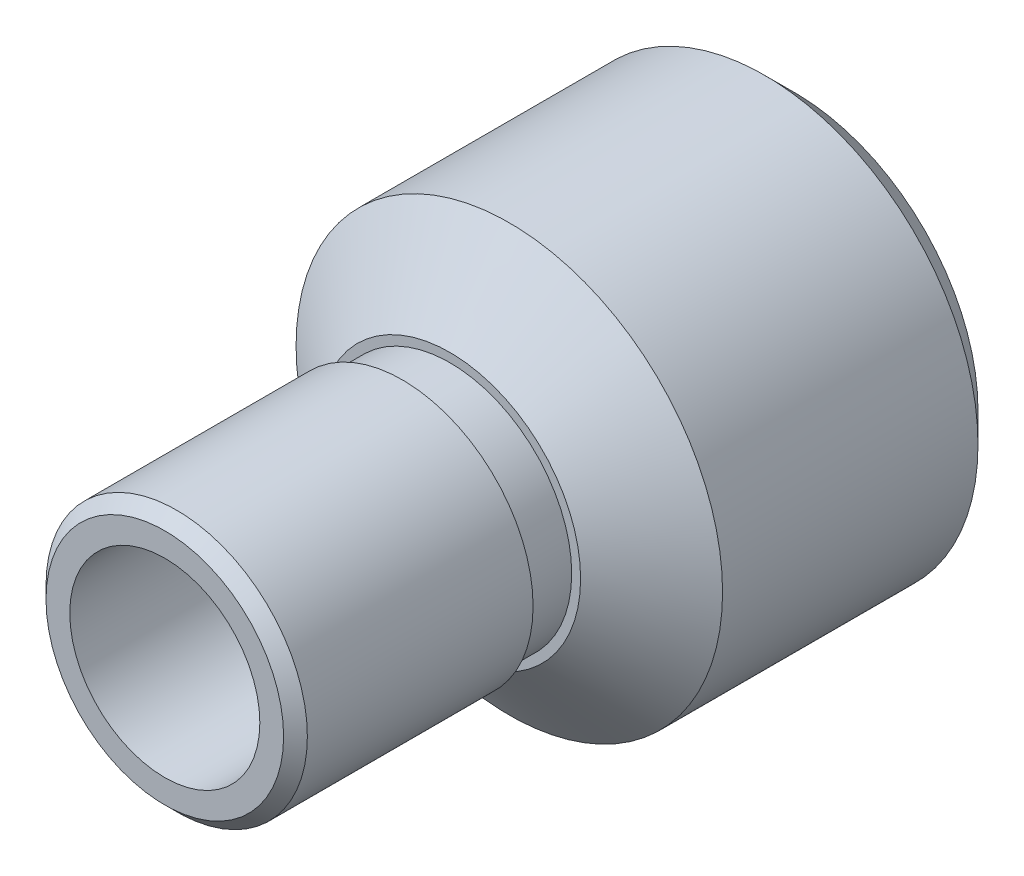
from build123d import *

# Parameters (mm, degrees)
CHAMFER1_SIZE      = 2.5
CUT_EXTRUDE1_START = -24
SKETCH3_R          = 11
SKETCH3_R_2        = 10.25
CUT_EXTRUDE1_DEPTH = 4
CHAMFER2_SIZE      = 1


with BuildPart() as part:
    # Sketch2 → Revolve1 (revolve)
    with BuildSketch(Plane(origin=(0, 0, 0), x_dir=(0, 0, -1), z_dir=(1, 0, 0))):
        Polygon((0, 11), (24, 11), (29, 17.95), (53, 17.95), (53, 14.95), (30.537419245, 14.95), (25.537419245, 8), (0, 8), align=None)
    revolve(axis=Axis((0, 0, 0), (0, 0, -1)))

    # Chamfer1
    chamfer1_edges = [part.edges().sort_by_distance(p)[0] for p in [
        (0, -17.95, -53),
    ]]
    chamfer(chamfer1_edges, length=CHAMFER1_SIZE)

    # Sketch3 → Cut-Extrude1 (cut)
    with BuildSketch(Plane.XY.offset(CUT_EXTRUDE1_START)):
        Circle(SKETCH3_R)
        Circle(SKETCH3_R_2, mode=Mode.SUBTRACT)
    extrude(amount=CUT_EXTRUDE1_DEPTH, mode=Mode.SUBTRACT)

    # Chamfer2
    chamfer2_edges = [part.edges().sort_by_distance(p)[0] for p in [
        (0, -11, 0),
    ]]
    chamfer(chamfer2_edges, length=CHAMFER2_SIZE)


solid = part.part
